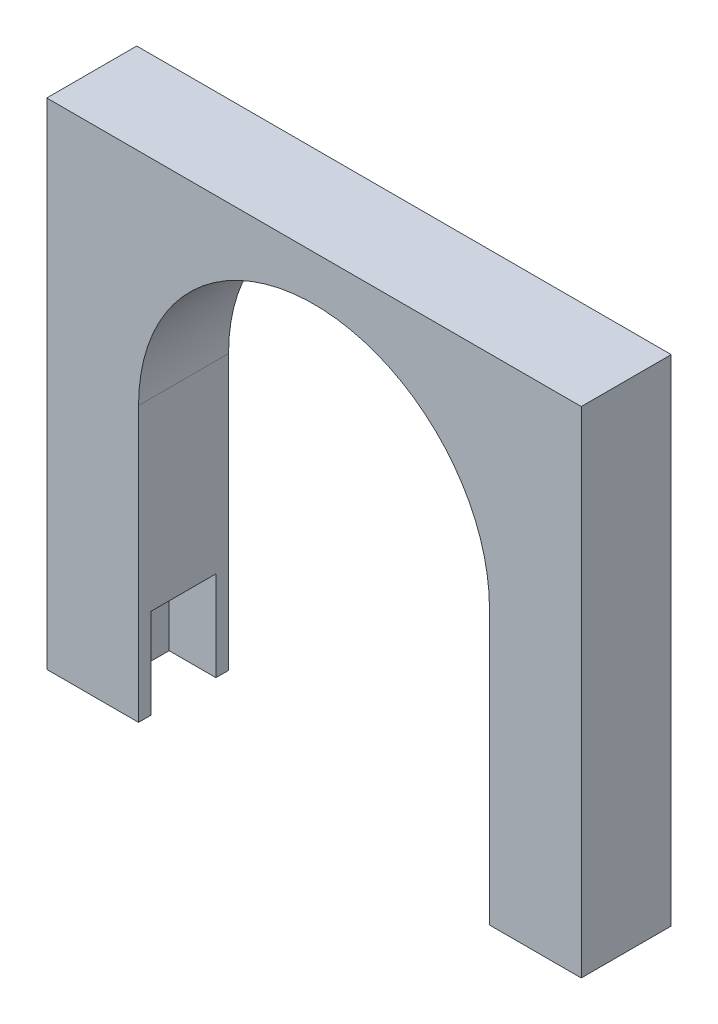
from build123d import *

# Parameters (mm, degrees)
SALIENTE_EXTRUIR1_DEPTH = 10
CORTAR_EXTRUIR1_DEPTH   = 10


with BuildPart() as part:
    # Croquis2 → Saliente-Extruir1 (new body)
    with BuildSketch(Plane.XY):
        with BuildLine():
            Line((-19.5, 0), (-29.7, 0))
            Line((-29.7, 0), (-29.7, 55))
            Line((-29.7, 55), (29.7, 55))
            Line((29.7, 55), (29.7, 0))
            Line((29.7, 0), (19.5, 0))
            Line((19.5, 0), (19.5, 30.5))
            ThreePointArc((19.5, 30.5), (0, 50), (-19.5, 30.5))
            Line((-19.5, 30.5), (-19.5, 0))
        make_face()
    extrude(amount=SALIENTE_EXTRUIR1_DEPTH)

    # Croquis3 → Cortar-Extruir1 (cut)
    with BuildSketch(Plane.XZ):
        Polygon((19.5, 5), (19.5, 8.6), (24.7, 8.6), (24.7, 1.4), (19.5, 1.4), align=None)
        Polygon((-24.7, 1.4), (-19.5, 1.4), (-19.5, 5), (-19.5, 8.6), (-24.7, 8.6), align=None)
    extrude(amount=-CORTAR_EXTRUIR1_DEPTH, mode=Mode.SUBTRACT)


solid = part.part
